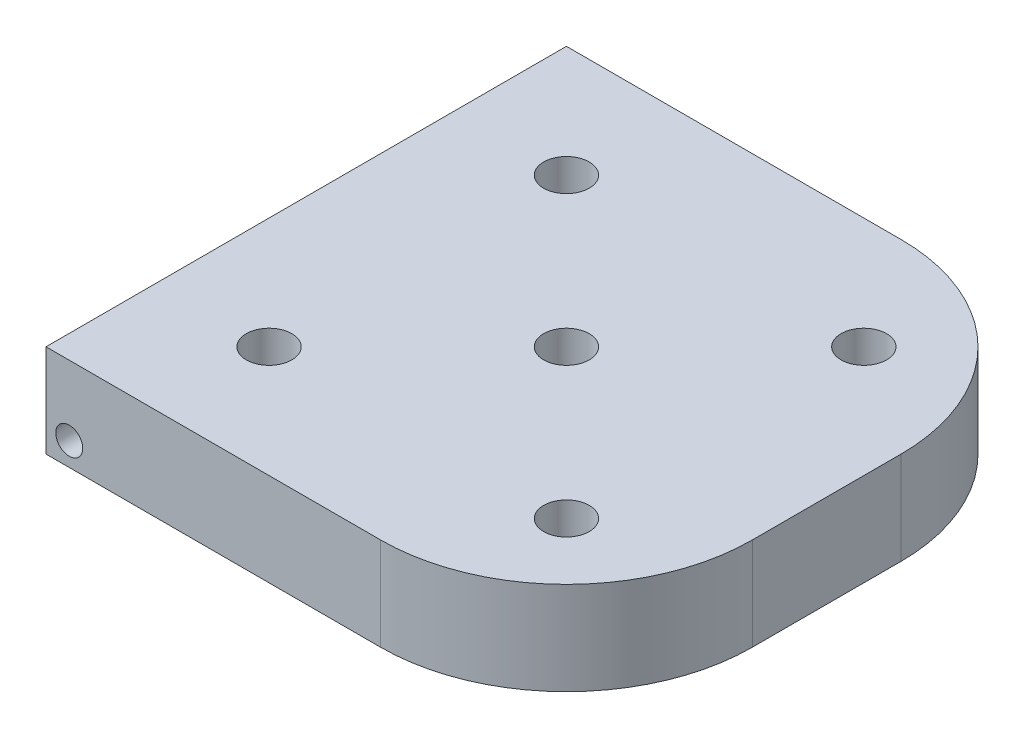
from build123d import *

# Parameters (mm, degrees)
SKETCH1_W           = 56
SKETCH1_H           = 56
SKETCH1_R           = 2.45
BOSS_EXTRUDE1_DEPTH = 10
SKETCH2_R           = 1.45
CUT_EXTRUDE1_DEPTH  = 80.824808174
FILLET1_R           = 20


with BuildPart() as part:
    # Sketch1 → Boss-Extrude1 (new body)
    with BuildSketch(Plane(origin=(0, 0, 0), x_dir=(1, 0, 0), z_dir=(0, 1, 0))):
        with Locations((28, 28)):
            Rectangle(SKETCH1_W, SKETCH1_H)
        with Locations(Location((28, 28, 0), (0, 0, 270))):
            Circle(SKETCH1_R, mode=Mode.SUBTRACT)
        with Locations(Location((12, 44, 0), (0, 0, 270))):
            Circle(SKETCH1_R, mode=Mode.SUBTRACT)
        with Locations(Location((44, 44, 0), (0, 0, 270))):
            Circle(SKETCH1_R, mode=Mode.SUBTRACT)
        with Locations(Location((44, 12, 0), (0, 0, 270))):
            Circle(SKETCH1_R, mode=Mode.SUBTRACT)
        with Locations(Location((12, 12, 0), (0, 0, 270))):
            Circle(SKETCH1_R, mode=Mode.SUBTRACT)
    extrude(amount=BOSS_EXTRUDE1_DEPTH)

    # Sketch2 → Cut-Extrude1 (cut, through all)
    with BuildSketch(Plane.XY):
        with Locations((2.5, 2.5)):
            Circle(SKETCH2_R)
    extrude(amount=-CUT_EXTRUDE1_DEPTH, mode=Mode.SUBTRACT)

    # Fillet1
    fillet1_edges = [part.edges().sort_by_distance(p)[0] for p in [
        (56, 5, -56),
        (56, 5, 0),
    ]]
    fillet(fillet1_edges, radius=FILLET1_R)


solid = part.part
